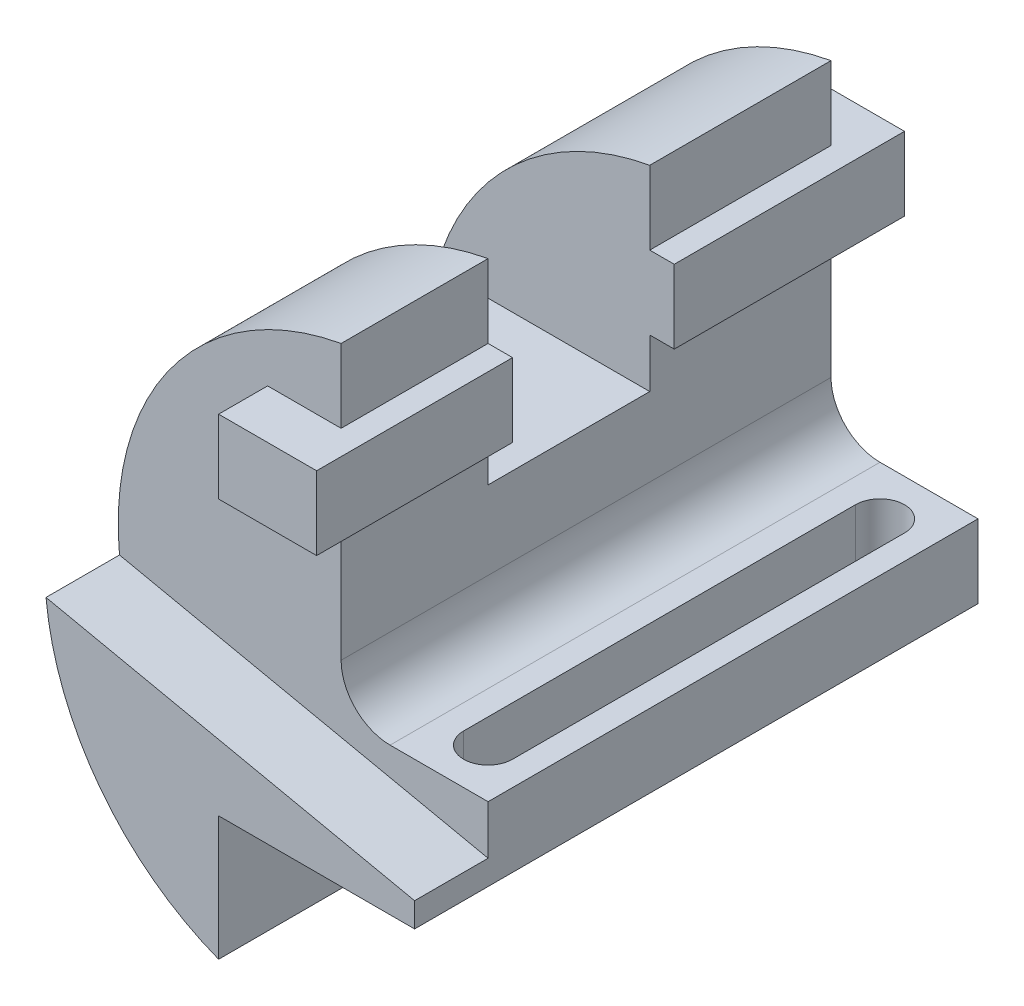
from build123d import *

# Parameters (mm, degrees)
BOSS_EXTRUDE1_DEPTH     = 100
FILLET1_R               = 10
BOSS_EXTRUDE2_DEPTH     = 15
SKETCH3_W               = 20
SKETCH3_H               = 15
BOSS_EXTRUDE3_DEPTH     = 10
SKETCH4_W               = 20
SKETCH4_H               = 15
BOSS_EXTRUDE4_DEPTH     = 10
CUT_EXTRUDE2_DEPTH      = 147.23952954
CUT_EXTRUDE2_DEPTH_BACK = 147.23952954
SKETCH5_W               = 33
SKETCH5_H               = 40
CUT_EXTRUDE3_DEPTH      = 147.23952954
CUT_EXTRUDE3_DEPTH_BACK = 10


with BuildPart() as part:
    # Sketch1 → Boss-Extrude1 (new body)
    with BuildSketch(Plane.XY):
        with BuildLine():
            Line((0, 0), (40, 0))
            Line((40, 0), (40, 15))
            Line((40, 15), (10, 15))
            Line((10, 15), (10, 51))
            Line((10, 51), (15, 51))
            Line((15, 51), (15, 66))
            Line((15, 66), (10, 66))
            Line((10, 66), (10, 81))
            ThreePointArc((10, 81), (-35.256322222, 31.603413808), (0, -25.362796982))
            Line((0, -25.362796982), (0, 0))
        make_face()
    extrude(amount=BOSS_EXTRUDE1_DEPTH)

    # Fillet1
    fillet1_edges = [part.edges().sort_by_distance(p)[0] for p in [
        (10, 15, 50),
    ]]
    fillet(fillet1_edges, radius=FILLET1_R)

    # Sketch2 → Boss-Extrude2 (add)
    with BuildSketch(Plane.XY.offset(100)):
        with BuildLine():
            Line((40, 5), (-35.235044142, 20.9917023))
            ThreePointArc((-35.235044142, 20.9917023), (-24.184418834, -7.177185713), (0, -25.362796982))
            Line((0, -25.362796982), (0, 0))
            Line((0, 0), (40, 0))
            Line((40, 0), (40, 5))
        make_face()
    extrude(amount=BOSS_EXTRUDE2_DEPTH)

    # Sketch3 → Boss-Extrude3 (add)
    with BuildSketch(Plane.XY):
        with Locations((5, 58.5)):
            Rectangle(SKETCH3_W, SKETCH3_H)
    extrude(amount=-BOSS_EXTRUDE3_DEPTH)

    # Sketch4 → Boss-Extrude4 (add)
    with BuildSketch(Plane.XY.offset(100)):
        with Locations((5, 58.5)):
            Rectangle(SKETCH4_W, SKETCH4_H)
    extrude(amount=BOSS_EXTRUDE4_DEPTH)

    # Sketch5 → Cut-Extrude2 (cut, two sides: drawn at the far end of the back side and taken through both)
    with BuildSketch(Plane(origin=(0, 0, 0), x_dir=(0, 0, -1), z_dir=(1, 0, 0)).offset(-CUT_EXTRUDE2_DEPTH_BACK)):
        with Locations((-53.5, 61)):
            Rectangle(SKETCH5_W, SKETCH5_H)
    extrude(amount=CUT_EXTRUDE2_DEPTH + CUT_EXTRUDE2_DEPTH_BACK, mode=Mode.SUBTRACT)

    # Sketch6 → Cut-Extrude3 (cut, two sides: drawn at the far end of the back side and taken through both)
    with BuildSketch(Plane(origin=(0, 0, 0), x_dir=(1, 0, 0), z_dir=(0, 1, 0)).offset(-CUT_EXTRUDE3_DEPTH_BACK)):
        with BuildLine():
            Line((35, -10), (35, -90))
            ThreePointArc((35, -90), (30, -95), (25, -90))
            Line((25, -90), (25, -10))
            ThreePointArc((25, -10), (30, -5), (35, -10))
        make_face()
    extrude(amount=CUT_EXTRUDE3_DEPTH + CUT_EXTRUDE3_DEPTH_BACK, mode=Mode.SUBTRACT)


solid = part.part
